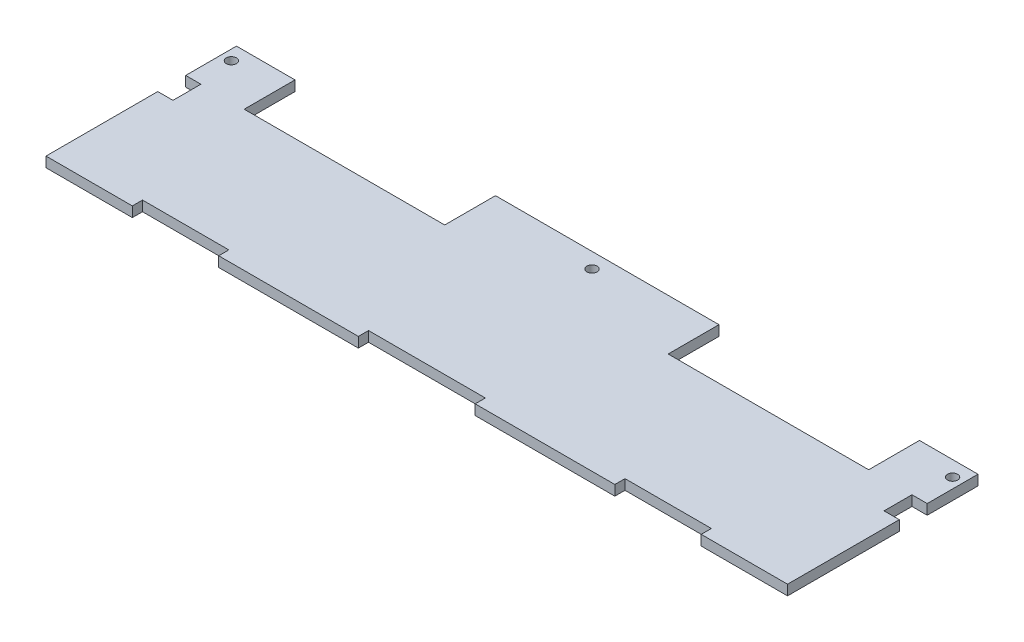
from build123d import *

# Parameters (mm, degrees)
SKETCH1_R           = 2
BOSS_EXTRUDE1_DEPTH = 4
SKETCH2_W           = 34
SKETCH2_H           = 4
SKETCH2_W_2         = 46
CUT_EXTRUDE1_DEPTH  = 151.792075389


with BuildPart() as part:
    # Sketch1 → Boss-Extrude1 (new body)
    with BuildSketch(Plane(origin=(0, 0, 0), x_dir=(1, 0, 0), z_dir=(0, 1, 0))):
        Polygon((146, -37.5), (-146, -37.5), (-146, 6.5), (-140, 6.5), (-140, 17.5), (-146, 17.5), (-146, 37.5), (-122.95, 37.5), (-122.95, 17.5), (-44, 17.5), (-44, 37.5), (44, 37.5), (44, 17.5), (122.95, 17.5), (122.95, 37.5), (146, 37.5), (146, 17.5), (140, 17.5), (140, 6.5), (146, 6.5), align=None)
        with Locations(Location((-142, 31.5, 0), (0, 0, 270))):
            Circle(SKETCH1_R, mode=Mode.SUBTRACT)
        with Locations(Location((142, 31.5, 0), (0, 0, 270))):
            Circle(SKETCH1_R, mode=Mode.SUBTRACT)
        with Locations(Location((0, 31.5, 0), (0, 0, 270))):
            Circle(SKETCH1_R, mode=Mode.SUBTRACT)
    extrude(amount=BOSS_EXTRUDE1_DEPTH)

    # Sketch2 → Cut-Extrude1 (cut, through all)
    with BuildSketch(Plane(origin=(0, 4, 0), x_dir=(1, 0, 0), z_dir=(0, 1, 0))):
        with Locations((95, -35.5)):
            Rectangle(SKETCH2_W, SKETCH2_H)
        with Locations((0, -35.5)):
            Rectangle(SKETCH2_W_2, SKETCH2_H)
        with Locations((-95, -35.5)):
            Rectangle(SKETCH2_W, SKETCH2_H)
    extrude(amount=-CUT_EXTRUDE1_DEPTH, mode=Mode.SUBTRACT)


solid = part.part
